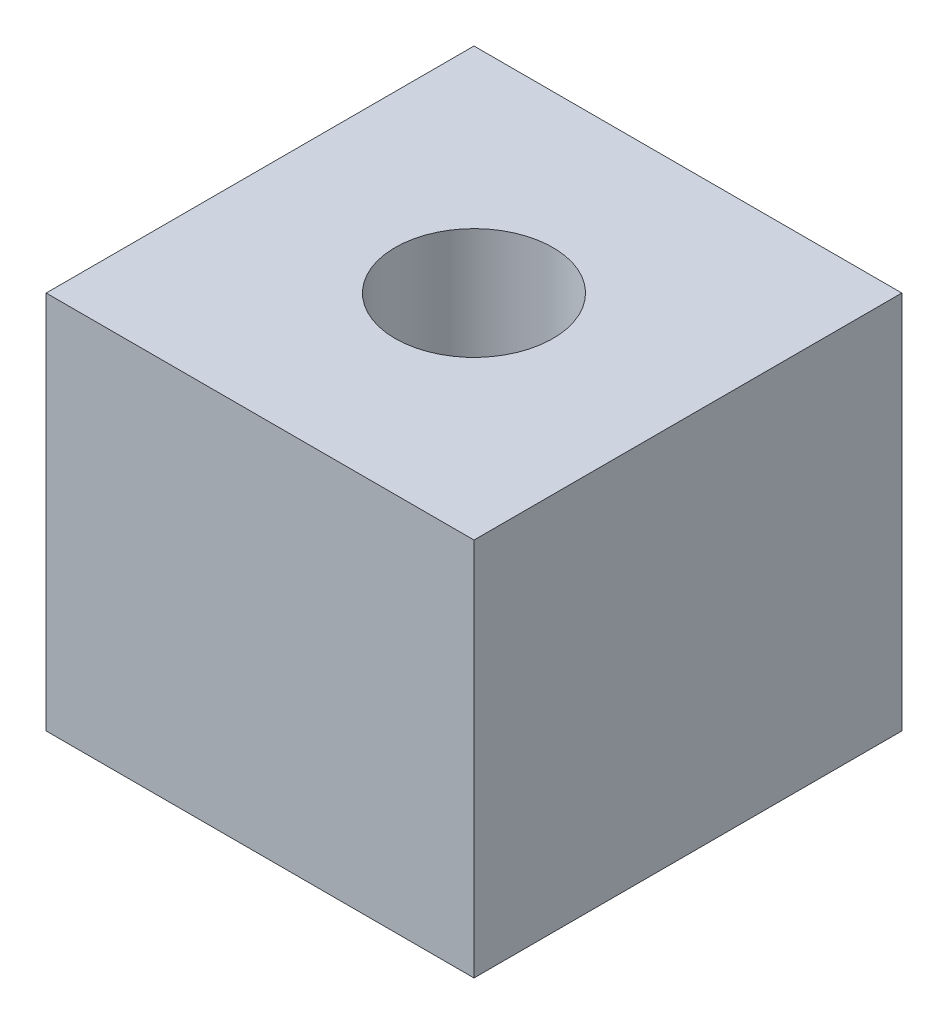
from build123d import *

# Parameters (mm, degrees)
SKETCH1_W           = 28.2
SKETCH1_H           = 28.2
BOSS_EXTRUDE1_DEPTH = 25
SKETCH1_4_R         = 5.2
CUT_EXTRUDE1_DEPTH  = 25
SKETCH1_5_R         = 1.5
CUT_EXTRUDE2_DEPTH  = 8
SKETCH1_6_R         = 11.1
SKETCH1_6_R_2       = 1.5
SKETCH1_6_R_3       = 5.2
CUT_EXTRUDE3_DEPTH  = 3.5
SKETCH2_R           = 1.5
CUT_EXTRUDE4_DEPTH  = 5


with BuildPart() as part:
    # Sketch1 → Boss-Extrude1 (new body)
    with BuildSketch(Plane(origin=(0, 0, 0), x_dir=(1, 0, 0), z_dir=(0, 1, 0))):
        Rectangle(SKETCH1_W, SKETCH1_H)
    extrude(amount=BOSS_EXTRUDE1_DEPTH)

    # Sketch1<4> → Cut-Extrude1 (cut)
    with BuildSketch(Plane(origin=(0, 0, 0), x_dir=(1, 0, 0), z_dir=(0, 1, 0))):
        Circle(SKETCH1_4_R)
    extrude(amount=CUT_EXTRUDE1_DEPTH, mode=Mode.SUBTRACT)

    # Sketch1<5> → Cut-Extrude2 (cut)
    with BuildSketch(Plane(origin=(0, 0, 0), x_dir=(1, 0, 0), z_dir=(0, 1, 0))):
        with Locations((8, 0)):
            Circle(SKETCH1_5_R)
        with Locations((0, -8)):
            Circle(SKETCH1_5_R)
        with Locations((-8, 0)):
            Circle(SKETCH1_5_R)
        with Locations((0, 8)):
            Circle(SKETCH1_5_R)
    extrude(amount=CUT_EXTRUDE2_DEPTH, mode=Mode.SUBTRACT)

    # Sketch1<6> → Cut-Extrude3 (cut)
    with BuildSketch(Plane(origin=(0, 0, 0), x_dir=(1, 0, 0), z_dir=(0, 1, 0))):
        Circle(SKETCH1_6_R)
        with Locations((0, -8)):
            Circle(SKETCH1_6_R_2, mode=Mode.SUBTRACT)
        Circle(SKETCH1_6_R_3, mode=Mode.SUBTRACT)
        with Locations((8, 0)):
            Circle(SKETCH1_6_R_2, mode=Mode.SUBTRACT)
        with Locations((-8, 0)):
            Circle(SKETCH1_6_R_2, mode=Mode.SUBTRACT)
        with Locations((0, 8)):
            Circle(SKETCH1_6_R_2, mode=Mode.SUBTRACT)
    extrude(amount=CUT_EXTRUDE3_DEPTH, mode=Mode.SUBTRACT)

    # Sketch2 → Cut-Extrude4 (cut)
    with BuildSketch(Plane.ZY.offset(14.1)):
        with Locations((-7.5, 20.5)):
            Circle(SKETCH2_R)
        with Locations((7.5, 20.5)):
            Circle(SKETCH2_R)
        with Locations((7.5, 4.5)):
            Circle(SKETCH2_R)
        with Locations((-7.5, 4.5)):
            Circle(SKETCH2_R)
    extrude(amount=-CUT_EXTRUDE4_DEPTH, mode=Mode.SUBTRACT)


solid = part.part
